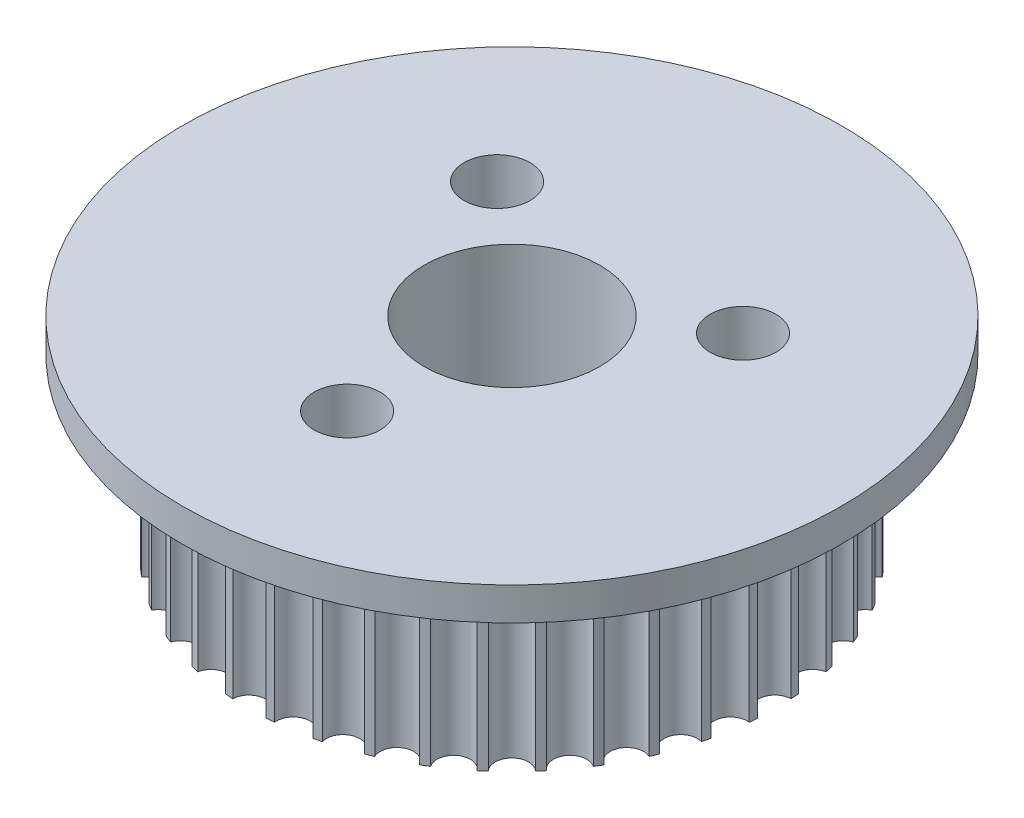
from build123d import *

# Parameters (mm, degrees)
BOSS_EXTRUDE1_DEPTH = 8
SKETCH2_R           = 15
BOSS_EXTRUDE2_DEPTH = 1.5
SKETCH4_R           = 4
SKETCH4_R_2         = 1.5
CUT_EXTRUDE1_DEPTH  = 23


with BuildPart() as part:
    # Sketch1 → Boss-Extrude1 (new body)
    with BuildSketch(Plane(origin=(0, 0, 0), x_dir=(1, 0, 0), z_dir=(0, 1, 0))):
        with BuildLine():
            ThreePointArc((-2.619011045, 11.679969227), (-2.794341005, 11.639267947), (-2.969039138, 11.595934917))
            ThreePointArc((-2.969039138, 11.595934917), (-3.464080507, 10.661343548), (-4.413916411, 11.126465832))
            ThreePointArc((-4.413916411, 11.126465832), (-4.580720685, 11.058838004), (-4.746489215, 10.988709666))
            ThreePointArc((-4.746489215, 10.988709666), (-5.089233502, 9.988183136), (-6.100136506, 10.298991922))
            ThreePointArc((-6.100136506, 10.298991922), (-6.25430782, 10.206102767), (-6.407064974, 10.110905915))
            ThreePointArc((-6.407064974, 10.110905915), (-6.589072678, 9.069080507), (-7.636150994, 9.21792265))
            ThreePointArc((-7.636150994, 9.21792265), (-7.773893139, 9.102059408), (-7.909877531, 8.984138103))
            ThreePointArc((-7.909877531, 8.984138103), (-7.926667017, 7.926667017), (-8.984138103, 7.909877531))
            ThreePointArc((-8.984138103, 7.909877531), (-9.102059408, 7.773893139), (-9.21792265, 7.636150994))
            ThreePointArc((-9.21792265, 7.636150994), (-9.069080507, 6.589072678), (-10.110905915, 6.407064974))
            ThreePointArc((-10.110905915, 6.407064974), (-10.206102767, 6.25430782), (-10.298991922, 6.100136506))
            ThreePointArc((-10.298991922, 6.100136506), (-9.988183136, 5.089233502), (-10.988709666, 4.746489215))
            ThreePointArc((-10.988709666, 4.746489215), (-11.058838004, 4.580720685), (-11.126465832, 4.413916411))
            ThreePointArc((-11.126465832, 4.413916411), (-10.661343548, 3.464080507), (-11.595934917, 2.969039138))
            ThreePointArc((-11.595934917, 2.969039138), (-11.639267947, 2.794341005), (-11.679969227, 2.619011045))
            ThreePointArc((-11.679969227, 2.619011045), (-11.071986298, 1.753630353), (-11.917629765, 1.118481464))
            ThreePointArc((-11.917629765, 1.118481464), (-11.933100485, 0.939155376), (-11.945873016, 0.759616935))
            ThreePointArc((-11.945873016, 0.759616935), (-11.21, 0), (-11.945873016, -0.759616935))
            ThreePointArc((-11.945873016, -0.759616935), (-11.933100485, -0.939155376), (-11.917629765, -1.118481464))
            ThreePointArc((-11.917629765, -1.118481464), (-11.071986298, -1.753630353), (-11.679969227, -2.619011045))
            ThreePointArc((-11.679969227, -2.619011045), (-11.639267947, -2.794341005), (-11.595934917, -2.969039138))
            ThreePointArc((-11.595934917, -2.969039138), (-10.661343548, -3.464080507), (-11.126465832, -4.413916411))
            ThreePointArc((-11.126465832, -4.413916411), (-11.058838004, -4.580720685), (-10.988709666, -4.746489215))
            ThreePointArc((-10.988709666, -4.746489215), (-9.988183136, -5.089233502), (-10.298991922, -6.100136506))
            ThreePointArc((-10.298991922, -6.100136506), (-10.206102767, -6.25430782), (-10.110905915, -6.407064974))
            ThreePointArc((-10.110905915, -6.407064974), (-9.069080507, -6.589072678), (-9.21792265, -7.636150994))
            ThreePointArc((-9.21792265, -7.636150994), (-9.102059408, -7.773893139), (-8.984138103, -7.909877531))
            ThreePointArc((-8.984138103, -7.909877531), (-7.926667017, -7.926667017), (-7.909877531, -8.984138103))
            ThreePointArc((-7.909877531, -8.984138103), (-7.773893139, -9.102059408), (-7.636150994, -9.21792265))
            ThreePointArc((-7.636150994, -9.21792265), (-6.589072678, -9.069080507), (-6.407064974, -10.110905915))
            ThreePointArc((-6.407064974, -10.110905915), (-6.25430782, -10.206102767), (-6.100136506, -10.298991922))
            ThreePointArc((-6.100136506, -10.298991922), (-5.089233502, -9.988183136), (-4.746489215, -10.988709666))
            ThreePointArc((-4.746489215, -10.988709666), (-4.580720685, -11.058838004), (-4.413916411, -11.126465832))
            ThreePointArc((-4.413916411, -11.126465832), (-3.464080507, -10.661343548), (-2.969039138, -11.595934917))
            ThreePointArc((-2.969039138, -11.595934917), (-2.794341005, -11.639267947), (-2.619011045, -11.679969227))
            ThreePointArc((-2.619011045, -11.679969227), (-1.753630353, -11.071986298), (-1.118481464, -11.917629765))
            ThreePointArc((-1.118481464, -11.917629765), (-0.939155376, -11.933100485), (-0.759616935, -11.945873016))
            ThreePointArc((-0.759616935, -11.945873016), (0, -11.21), (0.759616935, -11.945873016))
            ThreePointArc((0.759616935, -11.945873016), (0.939155376, -11.933100485), (1.118481464, -11.917629765))
            ThreePointArc((1.118481464, -11.917629765), (1.753630353, -11.071986298), (2.619011045, -11.679969227))
            ThreePointArc((2.619011045, -11.679969227), (2.794341005, -11.639267947), (2.969039138, -11.595934917))
            ThreePointArc((2.969039138, -11.595934917), (3.464080507, -10.661343548), (4.413916411, -11.126465832))
            ThreePointArc((4.413916411, -11.126465832), (4.580720685, -11.058838004), (4.746489215, -10.988709666))
            ThreePointArc((4.746489215, -10.988709666), (5.089233502, -9.988183136), (6.100136506, -10.298991922))
            ThreePointArc((6.100136506, -10.298991922), (6.25430782, -10.206102767), (6.407064974, -10.110905915))
            ThreePointArc((6.407064974, -10.110905915), (6.589072678, -9.069080507), (7.636150994, -9.21792265))
            ThreePointArc((7.636150994, -9.21792265), (7.773893139, -9.102059408), (7.909877531, -8.984138103))
            ThreePointArc((7.909877531, -8.984138103), (7.926667017, -7.926667017), (8.984138103, -7.909877531))
            ThreePointArc((8.984138103, -7.909877531), (9.102059408, -7.773893139), (9.21792265, -7.636150994))
            ThreePointArc((9.21792265, -7.636150994), (9.069080507, -6.589072678), (10.110905915, -6.407064974))
            ThreePointArc((10.110905915, -6.407064974), (10.206102767, -6.25430782), (10.298991922, -6.100136506))
            ThreePointArc((10.298991922, -6.100136506), (9.988183136, -5.089233502), (10.988709666, -4.746489215))
            ThreePointArc((10.988709666, -4.746489215), (11.058838004, -4.580720685), (11.126465832, -4.413916411))
            ThreePointArc((11.126465832, -4.413916411), (10.661343548, -3.464080507), (11.595934917, -2.969039138))
            ThreePointArc((11.595934917, -2.969039138), (11.639267947, -2.794341005), (11.679969227, -2.619011045))
            ThreePointArc((11.679969227, -2.619011045), (11.071986298, -1.753630353), (11.917629765, -1.118481464))
            ThreePointArc((11.917629765, -1.118481464), (11.933100485, -0.939155376), (11.945873016, -0.759616935))
            ThreePointArc((11.945873016, -0.759616935), (11.21, 0), (11.945873016, 0.759616935))
            ThreePointArc((11.945873016, 0.759616935), (11.933100485, 0.939155376), (11.917629765, 1.118481464))
            ThreePointArc((11.917629765, 1.118481464), (11.071986298, 1.753630353), (11.679969227, 2.619011045))
            ThreePointArc((11.679969227, 2.619011045), (11.639267947, 2.794341005), (11.595934917, 2.969039138))
            ThreePointArc((11.595934917, 2.969039138), (10.661343548, 3.464080507), (11.126465832, 4.413916411))
            ThreePointArc((11.126465832, 4.413916411), (11.058838004, 4.580720685), (10.988709666, 4.746489215))
            ThreePointArc((10.988709666, 4.746489215), (9.988183136, 5.089233502), (10.298991922, 6.100136506))
            ThreePointArc((10.298991922, 6.100136506), (10.206102767, 6.25430782), (10.110905915, 6.407064974))
            ThreePointArc((10.110905915, 6.407064974), (9.069080507, 6.589072678), (9.21792265, 7.636150994))
            ThreePointArc((9.21792265, 7.636150994), (9.102059408, 7.773893139), (8.984138103, 7.909877531))
            ThreePointArc((8.984138103, 7.909877531), (7.926667017, 7.926667017), (7.909877531, 8.984138103))
            ThreePointArc((7.909877531, 8.984138103), (7.773893139, 9.102059408), (7.636150994, 9.21792265))
            ThreePointArc((7.636150994, 9.21792265), (6.589072678, 9.069080507), (6.407064974, 10.110905915))
            ThreePointArc((6.407064974, 10.110905915), (6.25430782, 10.206102767), (6.100136506, 10.298991922))
            ThreePointArc((6.100136506, 10.298991922), (5.089233502, 9.988183136), (4.746489215, 10.988709666))
            ThreePointArc((4.746489215, 10.988709666), (4.580720685, 11.058838004), (4.413916411, 11.126465832))
            ThreePointArc((4.413916411, 11.126465832), (3.464080507, 10.661343548), (2.969039138, 11.595934917))
            ThreePointArc((2.969039138, 11.595934917), (2.794341005, 11.639267947), (2.619011045, 11.679969227))
            ThreePointArc((2.619011045, 11.679969227), (1.753630353, 11.071986298), (1.118481464, 11.917629765))
            ThreePointArc((1.118481464, 11.917629765), (0.939155376, 11.933100485), (0.759616935, 11.945873016))
            ThreePointArc((0.759616935, 11.945873016), (0, 11.21), (-0.759616935, 11.945873016))
            ThreePointArc((-0.759616935, 11.945873016), (-0.939155376, 11.933100485), (-1.118481464, 11.917629765))
            ThreePointArc((-1.118481464, 11.917629765), (-1.753630353, 11.071986298), (-2.619011045, 11.679969227))
        make_face()
    extrude(amount=BOSS_EXTRUDE1_DEPTH)

    # Sketch2 → Boss-Extrude2 (add)
    with BuildSketch(Plane(origin=(0, 8, 0), x_dir=(1, 0, 0), z_dir=(0, 1, 0))):
        with Locations(Location((0, 0, 0), (0, 0, 270))):
            Circle(SKETCH2_R)
    extrude(amount=BOSS_EXTRUDE2_DEPTH)

    # Sketch4 → Cut-Extrude1 (cut)
    with BuildSketch(Plane.XZ):
        with Locations(Location((0, 0, 0), (0, 0, 270))):
            Circle(SKETCH4_R)
        with Locations(Location((0, 7.5, 0), (0, 0, 270))):
            Circle(SKETCH4_R_2)
        with Locations(Location((5.944938911, -4.572493996, 0), (0, 0, 270))):
            Circle(SKETCH4_R_2)
        with Locations(Location((-5.630988244, -4.953985406, 0), (0, 0, 270))):
            Circle(SKETCH4_R_2)
    extrude(amount=-CUT_EXTRUDE1_DEPTH, mode=Mode.SUBTRACT)


solid = part.part
